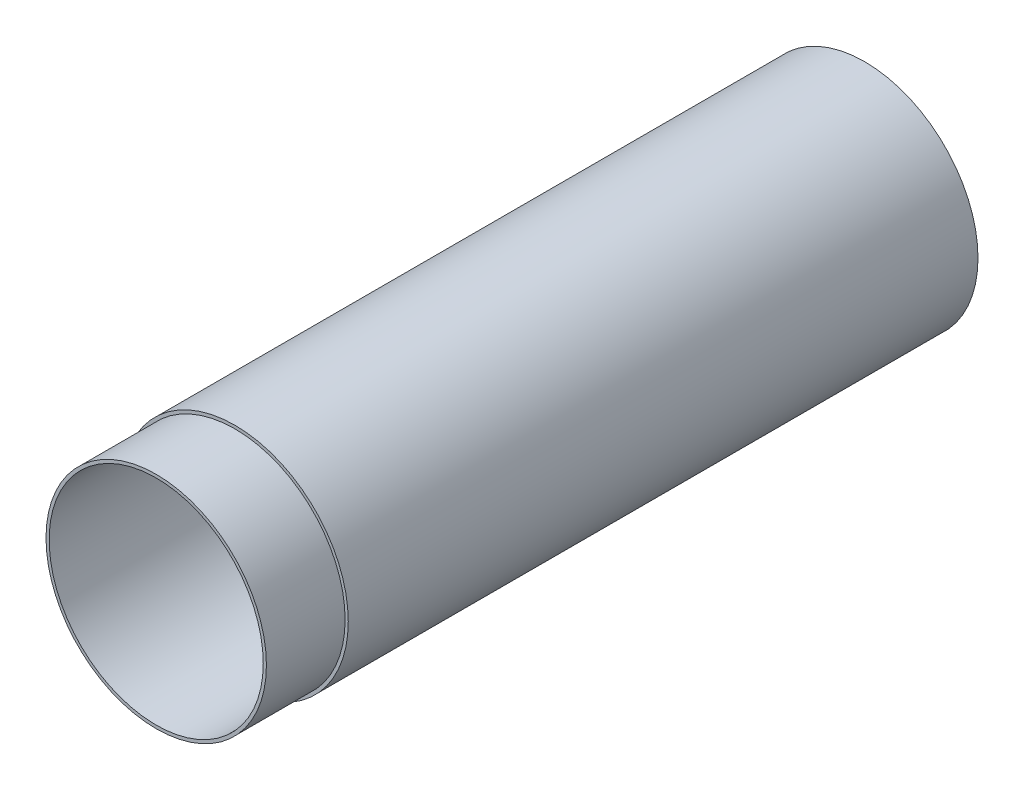
from build123d import *

# Parameters (mm, degrees)
ESQUISSE1_R             = 36
ESQUISSE1_R_2           = 34
BOSS_EXTRU_1_DEPTH      = 225
ENL_V_START             = -25
ESQUISSE2_R             = 36
ESQUISSE2_R_2           = 35
ENL_V_MAT_EXTRU_1_DEPTH = 25


with BuildPart() as part:
    # Esquisse1 → Boss.-Extru.1 (new body)
    with BuildSketch(Plane.XY):
        Circle(ESQUISSE1_R)
        Circle(ESQUISSE1_R_2, mode=Mode.SUBTRACT)
    extrude(amount=BOSS_EXTRU_1_DEPTH)

    # Esquisse2 → Enlèv. mat.-Extru.1 (cut)
    with BuildSketch(Plane.XY.offset(225).offset(ENL_V_START)):
        Circle(ESQUISSE2_R)
        Circle(ESQUISSE2_R_2, mode=Mode.SUBTRACT)
    extrude(amount=ENL_V_MAT_EXTRU_1_DEPTH, mode=Mode.SUBTRACT)


solid = part.part
